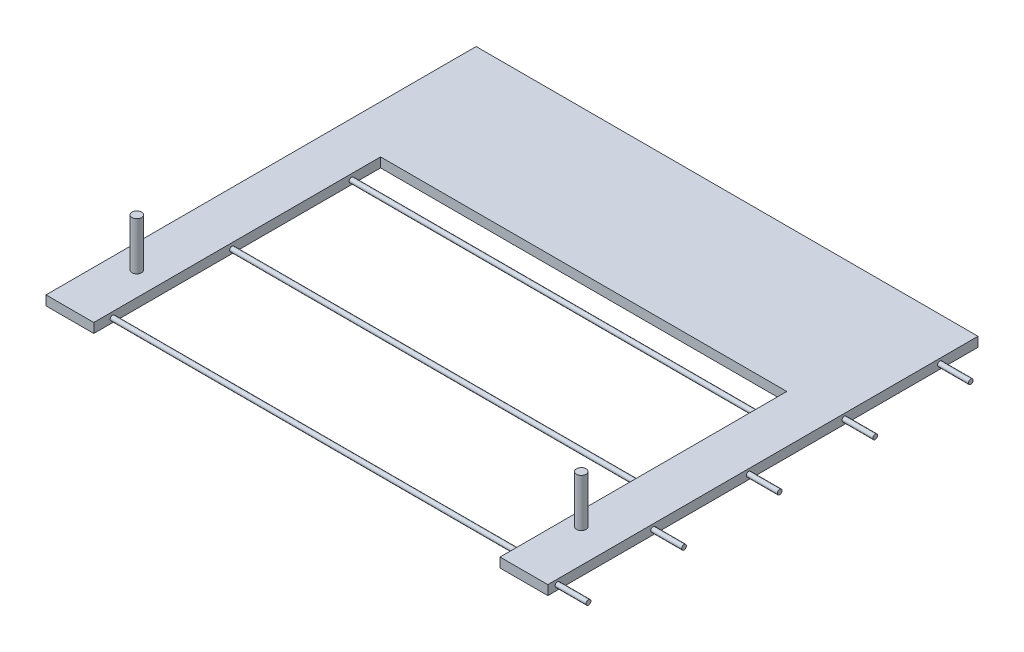
from build123d import *

# Parameters (mm, degrees)
SKETCH_1_W          = 105
SKETCH_1_H          = 100
EXTRUDE_1_DEPTH     = 2
SKETCH_2_W          = 85
SKETCH_2_H          = 60
CUT_EXTRUDE_1_DEPTH = 2
SKETCH_4_R          = 1
EXTRUDE_2_DEPTH     = 10
SKETCH_5_W          = 105
SKETCH_5_H          = 10
CUT_EXTRUDE_2_DEPTH = 10
SKETCH_7_R          = 0.5
EXTRUDE_3_DEPTH     = 6.4724949
SKETCH_8_R          = 0.5
EXTRUDE_4_DEPTH     = 85


with BuildPart() as part:
    # 스케치1 → 보스-돌출1 (new body)
    with BuildSketch(Plane(origin=(0, 0, 0), x_dir=(1, 0, 0), z_dir=(0, 1, 0))):
        Rectangle(SKETCH_1_W, SKETCH_1_H)
    extrude(amount=EXTRUDE_1_DEPTH)

    # 스케치2 → 컷-돌출1 (cut)
    with BuildSketch(Plane(origin=(0, 2, 0), x_dir=(1, 0, 0), z_dir=(0, 1, 0))):
        with Locations((0, -20)):
            Rectangle(SKETCH_2_W, SKETCH_2_H)
    extrude(amount=-CUT_EXTRUDE_1_DEPTH, mode=Mode.SUBTRACT)

    # 스케치4 → 보스-돌출2 (add)
    with BuildSketch(Plane(origin=(0, 2, 0), x_dir=(1, 0, 0), z_dir=(0, 1, 0))):
        with Locations(Location((45.5, -36, 0), (0, 0, 270))):
            Circle(SKETCH_4_R)
        with Locations(Location((-47.5, -36, 0), (0, 0, 270))):
            Circle(SKETCH_4_R)
    extrude(amount=EXTRUDE_2_DEPTH)

    # 스케치5 → 컷-돌출2 (cut)
    with BuildSketch(Plane(origin=(0, 2, 0), x_dir=(1, 0, 0), z_dir=(0, 1, 0))):
        with Locations((0, 45)):
            Rectangle(SKETCH_5_W, SKETCH_5_H)
    extrude(amount=-CUT_EXTRUDE_2_DEPTH, mode=Mode.SUBTRACT)

    # 스케치7 → 보스-돌출3 (add)
    with BuildSketch(Plane(origin=(52.5, 0, 0), x_dir=(0, 0, -1), z_dir=(1, 0, 0))):
        with Locations(Location((-47.972067637, 1, 0), (0, 0, 180))):
            Circle(SKETCH_7_R)
        with Locations(Location((-27.972067637, 1, 0), (0, 0, 180))):
            Circle(SKETCH_7_R)
        with Locations(Location((-7.972067637, 1, 0), (0, 0, 180))):
            Circle(SKETCH_7_R)
        with Locations(Location((12.027932363, 1, 0), (0, 0, 180))):
            Circle(SKETCH_7_R)
        with Locations(Location((32.027932363, 1, 0), (0, 0, 180))):
            Circle(SKETCH_7_R)
    extrude(amount=EXTRUDE_3_DEPTH)

    # 스케치8 → 보스-돌출4 (add)
    with BuildSketch(Plane(origin=(-42.5, 0, 0), x_dir=(0, 0, -1), z_dir=(1, 0, 0))):
        with Locations((-46.082216043, 0.875077013)):
            Circle(SKETCH_8_R)
        with Locations((-21.082216043, 0.875077013)):
            Circle(SKETCH_8_R)
        with Locations((3.917783957, 0.875077013)):
            Circle(SKETCH_8_R)
    extrude(amount=EXTRUDE_4_DEPTH)


solid = part.part
